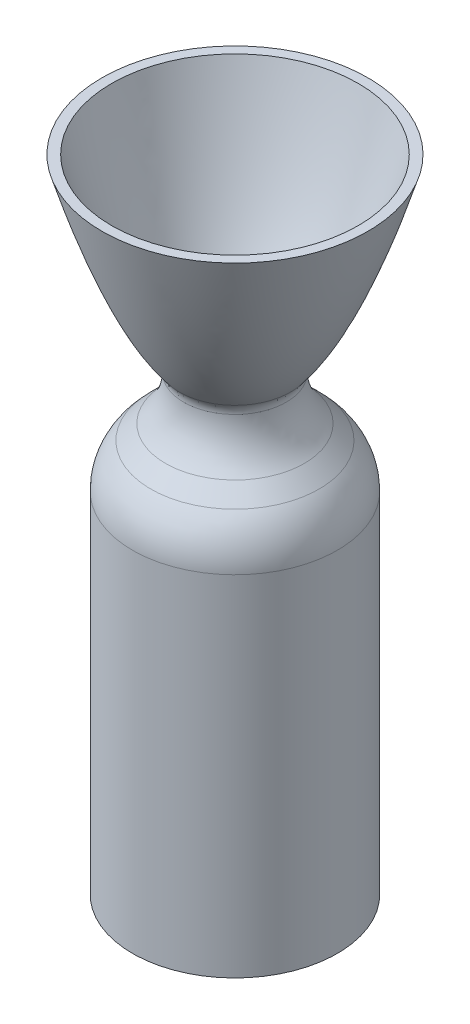
from build123d import *


with BuildPart() as part:
    # Sketch1 → Revolve2 (revolve)
    with BuildSketch(Plane.XY, mode=Mode.PRIVATE) as revolve2_sk:
        with BuildLine():
            Line((71.727523603, 109.92750764), (77.388416165, 109.92750764))
            add(Edge.make_bspline(
                [(32.495712479, 6.492229985), (54.951080007, 34.627531396), (77.388416165, 109.92750764)],
                knots=[0, 0, 0, 1, 1, 1], degree=2))
            add(Edge.make_bspline(
                [(29.79950115, -0.017009666), (29.799501776, 0.018882986), (29.800039607, 0.093104024), (29.802456999, 0.250631404), (29.808894844, 0.410054451), (29.820966875, 0.629754601), (29.841868363, 0.884423662), (29.875617995, 1.185527607), (29.926932581, 1.525040832), (29.990976977, 1.863987111), (30.067574877, 2.199344754), (30.156756847, 2.532229755), (30.258174689, 2.861082979), (30.372052346, 3.186337375), (30.497630047, 3.506617491), (30.635719253, 3.822657067), (30.784503576, 4.132272519), (30.946445498, 4.437773457), (31.11692178, 4.73429191), (31.302947997, 5.028694196), (31.492221546, 5.30850927), (31.70483875, 5.593717877), (31.87930965, 5.815903982), (32.066779032, 6.032941971), (32.204988524, 6.19163198), (32.370875346, 6.365112113), (32.444953537, 6.441469176), (32.495712479, 6.492229985)],
                knots=[0.082568816, 0.082568816, 0.082568816, 0.082568816, 0.082568816, 0.102426634, 0.122284453, 0.142142271, 0.162000089, 0.201715725, 0.241431362, 0.281146998, 0.320862634, 0.360578271, 0.400293907, 0.440009544, 0.47972518, 0.519440816, 0.559156453, 0.598872089, 0.638587725, 0.678303362, 0.718018998, 0.757734635, 0.797450271, 0.837165907, 0.857023726, 0.876881544, 0.91659718, 0.91659718, 0.91659718, 0.91659718, 0.91659718], degree=4))
            add(Edge.make_bspline(
                [(29.79950115, -0.017009666), (29.799502381, -0.087538311), (29.800031528, -0.230593853), (29.802407213, -0.56019258), (29.808731607, -0.84117006), (29.818216728, -1.211831735), (29.830859021, -1.530444722), (29.846659245, -1.878949267), (29.865614504, -2.210716535), (29.893252118, -2.635079064), (29.932720324, -3.139043611), (30.003732985, -3.896988339), (30.123559956, -4.903460052), (30.299919323, -6.073720425), (30.551318512, -7.40217608), (30.852228593, -8.72058418), (31.202203904, -10.026646875), (31.600794265, -11.318829264), (32.047378674, -12.595109003), (32.541436606, -13.853897152), (33.082106405, -15.093206798), (33.668912671, -16.311619464), (34.300572682, -17.506948466), (34.976965681, -18.67829743), (35.695878388, -19.822753071), (36.458455286, -20.94086975), (37.15960048, -21.891421437), (37.789169411, -22.690455158), (38.324561704, -23.337431817), (38.772689056, -23.857014696), (39.208883315, -24.346825927), (39.63625941, -24.805494071), (39.945991929, -25.130877992), (40.237293247, -25.426658729), (40.336845715, -25.526959614), (40.386716092, -25.5768318)],
                knots=[0.082637729, 0.082637729, 0.082637729, 0.082637729, 0.082637729, 0.092574926, 0.102512123, 0.11244932, 0.122386517, 0.132323714, 0.142260911, 0.152198108, 0.162135305, 0.182009699, 0.201884093, 0.24163288, 0.281381668, 0.321130456, 0.360879243, 0.400628031, 0.440376819, 0.480125606, 0.519874394, 0.559623181, 0.599371969, 0.639120757, 0.678869544, 0.718618332, 0.75836712, 0.798115907, 0.817990301, 0.837864695, 0.857739089, 0.877613483, 0.897487877, 0.907425074, 0.91736227, 0.91736227, 0.91736227, 0.91736227, 0.91736227], degree=4))
            Line((40.386716092, -25.5768318), (48.994344291, -34.184459998))
            add(Edge.make_bspline(
                [(59.581960968, -59.744683548), (59.581959736, -59.674153485), (59.581430593, -59.532576432), (59.579054743, -59.198734945), (59.572730144, -58.921965822), (59.563244656, -58.549737817), (59.550601759, -58.230007951), (59.530850931, -57.798764772), (59.500838589, -57.298130228), (59.456626426, -56.705168494), (59.377721756, -55.865650695), (59.277860165, -55.025336189), (59.157109089, -54.189605759), (58.987244125, -53.189595569), (58.792497489, -52.194613151), (58.566808422, -51.205709413), (58.310447525, -50.224659368), (58.029722641, -49.25024807), (57.724782039, -48.283139554), (57.33397113, -47.166305397), (56.839953659, -45.907578736), (56.29916705, -44.668139134), (55.712494225, -43.449871857), (55.080553527, -42.25426357), (54.404558525, -41.083325211), (53.684908815, -39.938142989), (52.923535432, -38.821246572), (52.220302354, -37.868622118), (51.593971231, -37.072842456), (51.053250974, -36.420551616), (50.615560241, -35.911417966), (50.215209482, -35.464162991), (49.881890795, -35.101801519), (49.574357917, -34.777510486), (49.374505699, -34.568719785), (49.144825365, -34.335686622), (49.044216443, -34.23433239), (48.994344291, -34.184459998)],
                knots=[0.082637729, 0.082637729, 0.082637729, 0.082637729, 0.082637729, 0.092574926, 0.102512123, 0.11244932, 0.122386517, 0.132323714, 0.142260911, 0.162135305, 0.182009699, 0.201884093, 0.24163288, 0.261507274, 0.281381668, 0.321130456, 0.360879243, 0.380753637, 0.400628031, 0.440376819, 0.480125606, 0.519874394, 0.559623181, 0.599371969, 0.639120757, 0.678869544, 0.718618332, 0.75836712, 0.798115907, 0.817990301, 0.837864695, 0.857739089, 0.877613483, 0.88755068, 0.897487877, 0.907425074, 0.91736227, 0.91736227, 0.91736227, 0.91736227, 0.91736227], degree=4))
            Line((59.581960968, -59.744683548), (59.581960968, -262.944683548))
            Line((59.581960968, -262.944683548), (53.881527661, -262.927513222))
            Line((53.881527661, -262.927513222), (53.881527661, -59.727513222))
            add(Edge.make_bspline(
                [(53.881527661, -59.727513222), (53.88152643, -59.65698316), (53.880997287, -59.515406106), (53.878621437, -59.18156462), (53.872296838, -58.904795496), (53.862811351, -58.532567491), (53.850168454, -58.212837625), (53.830417626, -57.781594446), (53.800405285, -57.280959903), (53.756193122, -56.687998169), (53.677288452, -55.848480369), (53.577426862, -55.008165864), (53.456675787, -54.172435434), (53.286810823, -53.172425243), (53.092064188, -52.177442825), (52.866375121, -51.188539087), (52.610014225, -50.207489042), (52.329289341, -49.233077744), (52.02434874, -48.265969227), (51.633537832, -47.14913507), (51.139520362, -45.890408409), (50.598733754, -44.650968807), (50.012060929, -43.432701529), (49.380120232, -42.237093242), (48.70412523, -41.066154882), (47.984475521, -39.92097266), (47.22310214, -38.804076242), (46.519869062, -37.851451788), (45.893537939, -37.055672125), (45.352817683, -36.403381285), (44.91512695, -35.894247635), (44.514776192, -35.44699266), (44.181457505, -35.084631188), (43.873924626, -34.760340154), (43.674072409, -34.551549453), (43.444392075, -34.31851629), (43.343783154, -34.217162058), (43.293911001, -34.167289665)],
                knots=[0.082637729, 0.082637729, 0.082637729, 0.082637729, 0.082637729, 0.092574926, 0.102512123, 0.11244932, 0.122386517, 0.132323714, 0.142260911, 0.162135305, 0.182009699, 0.201884093, 0.24163288, 0.261507274, 0.281381668, 0.321130456, 0.360879243, 0.380753637, 0.400628031, 0.440376819, 0.480125606, 0.519874394, 0.559623181, 0.599371969, 0.639120757, 0.678869544, 0.718618332, 0.75836712, 0.798115907, 0.817990301, 0.837864695, 0.857739089, 0.877613483, 0.88755068, 0.897487877, 0.907425074, 0.91736227, 0.91736227, 0.91736227, 0.91736227, 0.91736227], degree=4))
            Line((43.293911001, -34.167289665), (34.686282803, -25.559661467))
            add(Edge.make_bspline(
                [(24.099067874, 0.000160672), (24.099069105, -0.070367973), (24.099598252, -0.213423515), (24.101973937, -0.543022242), (24.108298331, -0.823999722), (24.117783452, -1.194661397), (24.130425744, -1.513274384), (24.146225968, -1.861778929), (24.165181227, -2.193546197), (24.19281884, -2.617908726), (24.232287047, -3.121873273), (24.303299707, -3.879818001), (24.423126678, -4.886289715), (24.599486043, -6.056550087), (24.850885233, -7.385005742), (25.151795313, -8.703413843), (25.501770623, -10.009476538), (25.900360983, -11.301658927), (26.346945391, -12.577938666), (26.841003322, -13.836726816), (27.381673121, -15.076036462), (27.968479386, -16.294449128), (28.600139397, -17.48977813), (29.276532395, -18.661127095), (29.995445101, -19.805582736), (30.758021999, -20.923699416), (31.459167192, -21.874251103), (32.088736122, -22.673284825), (32.624128416, -23.320261484), (33.072255767, -23.839844363), (33.508450026, -24.329655594), (33.935826121, -24.788323738), (34.245558639, -25.113707659), (34.536859957, -25.409488397), (34.636412425, -25.509789282), (34.686282803, -25.559661467)],
                knots=[0.082637729, 0.082637729, 0.082637729, 0.082637729, 0.082637729, 0.092574926, 0.102512123, 0.11244932, 0.122386517, 0.132323714, 0.142260911, 0.152198108, 0.162135305, 0.182009699, 0.201884093, 0.24163288, 0.281381668, 0.321130456, 0.360879243, 0.400628031, 0.440376819, 0.480125606, 0.519874394, 0.559623181, 0.599371969, 0.639120757, 0.678869544, 0.718618332, 0.75836712, 0.798115907, 0.817990301, 0.837864695, 0.857739089, 0.877613483, 0.897487877, 0.907425074, 0.91736227, 0.91736227, 0.91736227, 0.91736227, 0.91736227], degree=4))
            add(Edge.make_bspline(
                [(24.099067874, 0.000160672), (24.0990685, 0.036053324), (24.099606331, 0.110274362), (24.102023723, 0.267801742), (24.108461568, 0.427224789), (24.120533599, 0.646924939), (24.141435087, 0.901594), (24.175184719, 1.202697945), (24.226499305, 1.54221117), (24.290543701, 1.881157449), (24.367141601, 2.216515092), (24.456323571, 2.549400093), (24.557741413, 2.878253317), (24.671619071, 3.203507713), (24.797196771, 3.523787829), (24.935285977, 3.839827405), (25.084070301, 4.149442857), (25.246012222, 4.454943795), (25.416488505, 4.751462248), (25.602514721, 5.045864533), (25.79178827, 5.325679608), (26.004405474, 5.610888215), (26.178876374, 5.83307432), (26.366345756, 6.050112309), (26.504555248, 6.208802318), (26.67044207, 6.382282451), (26.744520261, 6.458639514), (26.795279203, 6.509400323)],
                knots=[0.082568816, 0.082568816, 0.082568816, 0.082568816, 0.082568816, 0.102426634, 0.122284453, 0.142142271, 0.162000089, 0.201715725, 0.241431362, 0.281146998, 0.320862634, 0.360578271, 0.400293907, 0.440009544, 0.47972518, 0.519440816, 0.559156453, 0.598872089, 0.638587725, 0.678303362, 0.718018998, 0.757734635, 0.797450271, 0.837165907, 0.857023726, 0.876881544, 0.91659718, 0.91659718, 0.91659718, 0.91659718, 0.91659718], degree=4))
            add(Edge.make_bspline(
                [(26.795279203, 6.509400323), (49.261401403, 34.636114842), (71.727523603, 109.92750764)],
                knots=[0, 0, 0, 1, 1, 1], degree=2))
        make_face()
    revolve(revolve2_sk.sketch.rotate(Axis((-0.005532126, 165.815985114, 0), (0, -1, 0)), 180), axis=Axis((-0.005532126, 165.815985114, 0), (0, -1, 0)))


solid = part.part
